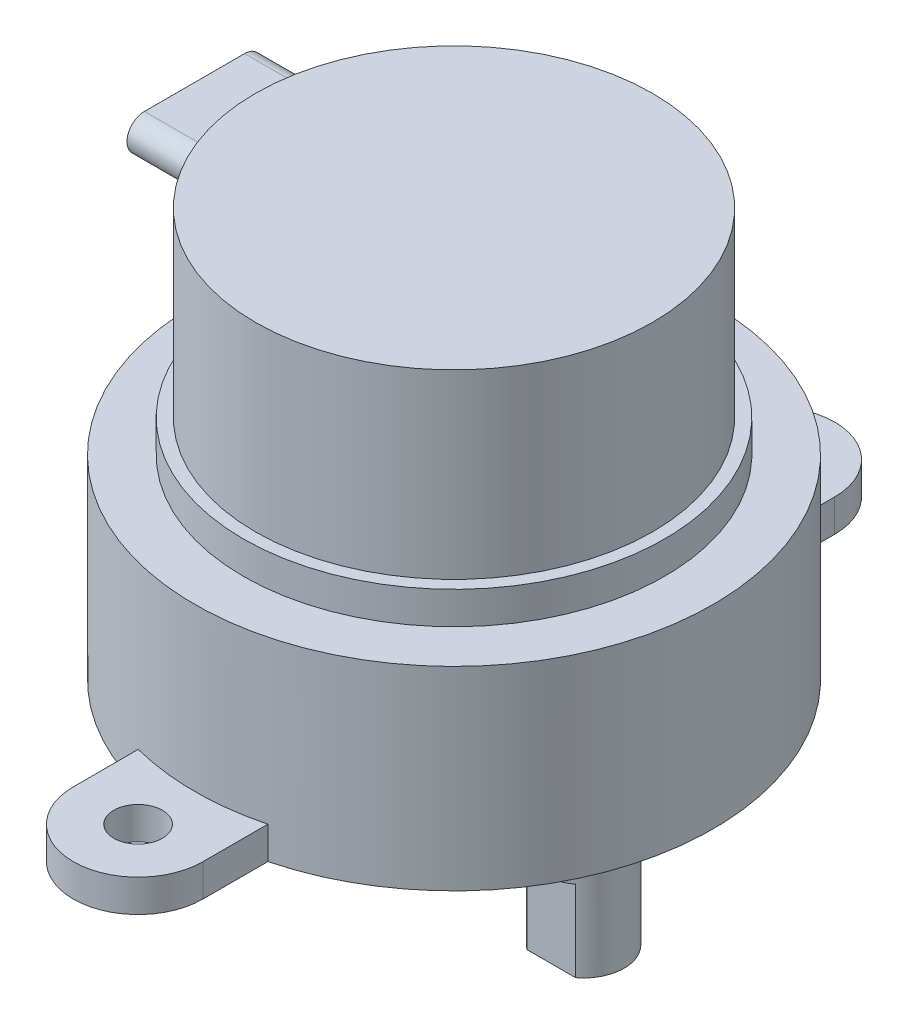
from build123d import *

# Parameters (mm, degrees)
HOLE_WIZARD_M3_1_D     = 2.5
HOLE_WIZARD_M3_1_DEPTH = 5
HOLE_WIZARD_M3_1_TIP   = 0.751075774
SKETCH_5_W             = 10.630358464
SKETCH_5_H             = 3.551561409
SKETCH_5_W_2           = 11.579063223
SKETCH_5_H_2           = 3.065046147
CUT_EXTRUDE_1_DEPTH    = 5
SKETCH_6_R             = 1.5
EXTRUDE_1_DEPTH        = 2
EXTRUDE_2_DEPTH        = 16


with BuildPart() as part:
    # 草图1 → 旋转1 (revolve)
    with BuildSketch(Plane.XY, mode=Mode.PRIVATE) as revolve_1_sk:
        Polygon((0, 0), (-16, 0), (-16, 12), (-13, 12), (-13, 14), (-12.25, 14), (-12.25, 25.2), (0, 25.2), align=None)
    revolve(revolve_1_sk.sketch.rotate(Axis((0, 0, 0), (0, 1, 0)), 270), axis=Axis((0, 0, 0), (0, 1, 0)))

    # 草图2 → 旋转2 (revolve)
    with BuildSketch(Plane.XY, mode=Mode.PRIVATE) as revolve_2_sk:
        Polygon((3.5, 0), (3.5, -1.25), (4, -1.25), (4, -2.7), (5.5, -2.7), (5.5, -10.2), (8, -10.2), (8, 0), align=None)
    revolve(revolve_2_sk.sketch.rotate(Axis((8, -10.2, 0), (0, 1, 0)), 270), axis=Axis((8, -10.2, 0), (0, 1, 0)))

    # M3 螺纹孔1
    with Locations(Plane(origin=(0, -10.2, 0), x_dir=(-1, 0, 0), z_dir=(0, -1, 0))):
        with Locations((-8, 0)):
            Hole(HOLE_WIZARD_M3_1_D / 2, depth=HOLE_WIZARD_M3_1_DEPTH)
            with Locations((0, 0, -(HOLE_WIZARD_M3_1_DEPTH + HOLE_WIZARD_M3_1_TIP / 2))):  # 118° drill point
                Cone(0, HOLE_WIZARD_M3_1_D / 2, HOLE_WIZARD_M3_1_TIP, mode=Mode.SUBTRACT)

    # 草图5 → 切除-拉伸1 (cut)
    with BuildSketch(Plane.XZ.offset(10.2)):
        with Locations((8.725419138, 3.775780705)):
            Rectangle(SKETCH_5_W, SKETCH_5_H)
        with Locations((9.759264069, -3.532523074)):
            Rectangle(SKETCH_5_W_2, SKETCH_5_H_2)
    extrude(amount=-CUT_EXTRUDE_1_DEPTH, mode=Mode.SUBTRACT)

    # 草图6 → 凸台-拉伸1 (add)
    with BuildSketch(Plane.XZ):
        with BuildLine():
            Line((-4, -19.5), (-4, 19.5))
            ThreePointArc((-4, 19.5), (0, 23.5), (4, 19.5))
            Line((4, 19.5), (4, -19.5))
            ThreePointArc((4, -19.5), (0, -23.5), (-4, -19.5))
        make_face()
        with Locations(Location((0, -19.5, 0), (0, 0, 270))):
            Circle(SKETCH_6_R, mode=Mode.SUBTRACT)
        with Locations(Location((0, 19.5, 0), (0, 0, 270))):
            Circle(SKETCH_6_R, mode=Mode.SUBTRACT)
    extrude(amount=-EXTRUDE_1_DEPTH)

    # 草图7 → 凸台-拉伸2 (add)
    with BuildSketch(Plane(origin=(0, 0, 0), x_dir=(0, 0, -1), z_dir=(1, 0, 0))):
        with BuildLine():
            Line((3.07585982, 21.752332949), (-3.109660478, 21.752332949))
            ThreePointArc((-3.109660478, 21.752332949), (-4.188603578, 22.83127605), (-3.109660478, 23.91021915))
            Line((-3.109660478, 23.91021915), (3.07585982, 23.91021915))
            ThreePointArc((3.07585982, 23.91021915), (4.154802921, 22.83127605), (3.07585982, 21.752332949))
        make_face()
    extrude(amount=-EXTRUDE_2_DEPTH)


solid = part.part
